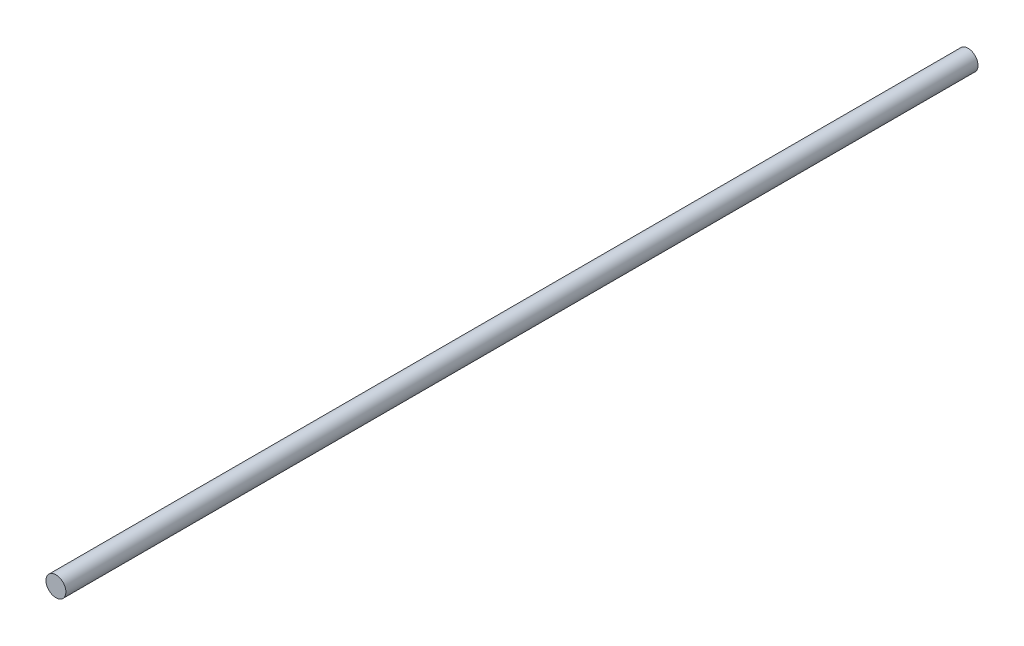
from build123d import *

# Parameters (mm, degrees)
SKETCH1_R           = 6
BOSS_EXTRUDE1_DEPTH = 550


with BuildPart() as part:
    # Sketch1 → Boss-Extrude1 (new body)
    with BuildSketch(Plane.XY):
        with Locations((-933, 964)):
            Circle(SKETCH1_R)
    extrude(amount=BOSS_EXTRUDE1_DEPTH)


solid = part.part
